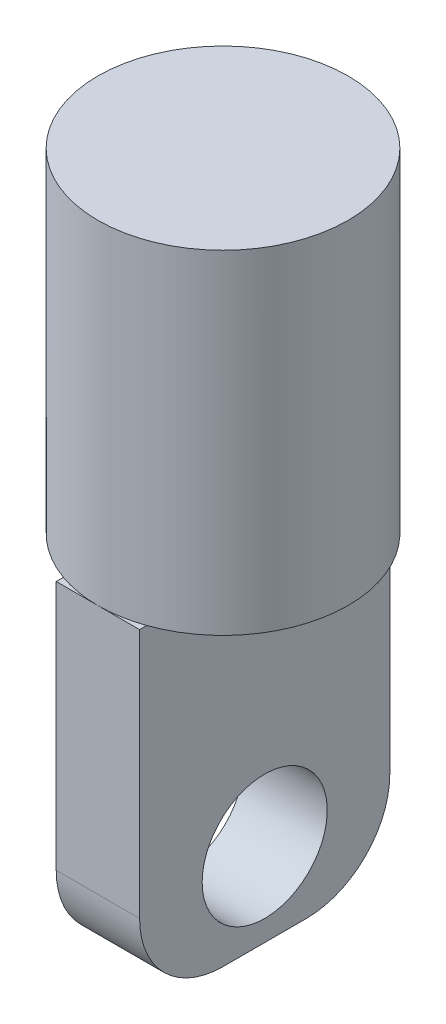
from build123d import *

# Parameters (mm, degrees)
SKETCH1_R           = 15
BOSS_EXTRUDE1_DEPTH = 40
SKETCH2_W           = 10
SKETCH2_H           = 30
BOSS_EXTRUDE2_DEPTH = 40
SKETCH3_R           = 7.5
CUT_EXTRUDE1_DEPTH  = 40
FILLET2_R           = 10


with BuildPart() as part:
    # Sketch1 → Boss-Extrude1 (new body)
    with BuildSketch(Plane(origin=(0, 0, 0), x_dir=(1, 0, 0), z_dir=(0, 1, 0))):
        with Locations(Location((0, 0, 0), (0, 0, 270))):
            Circle(SKETCH1_R)
    extrude(amount=BOSS_EXTRUDE1_DEPTH)

    # Sketch2 → Boss-Extrude2 (add)
    with BuildSketch(Plane.XZ):
        Rectangle(SKETCH2_W, SKETCH2_H)
    extrude(amount=BOSS_EXTRUDE2_DEPTH)

    # Sketch3 → Cut-Extrude1 (cut)
    with BuildSketch(Plane.ZY.offset(5)):
        with Locations((0, -30)):
            Circle(SKETCH3_R)
    extrude(amount=-CUT_EXTRUDE1_DEPTH, mode=Mode.SUBTRACT)

    # Fillet2
    fillet2_edges = [part.edges().sort_by_distance(p)[0] for p in [
        (0, -40, 15),
        (0, -40, -15),
    ]]
    fillet(fillet2_edges, radius=FILLET2_R)


solid = part.part
